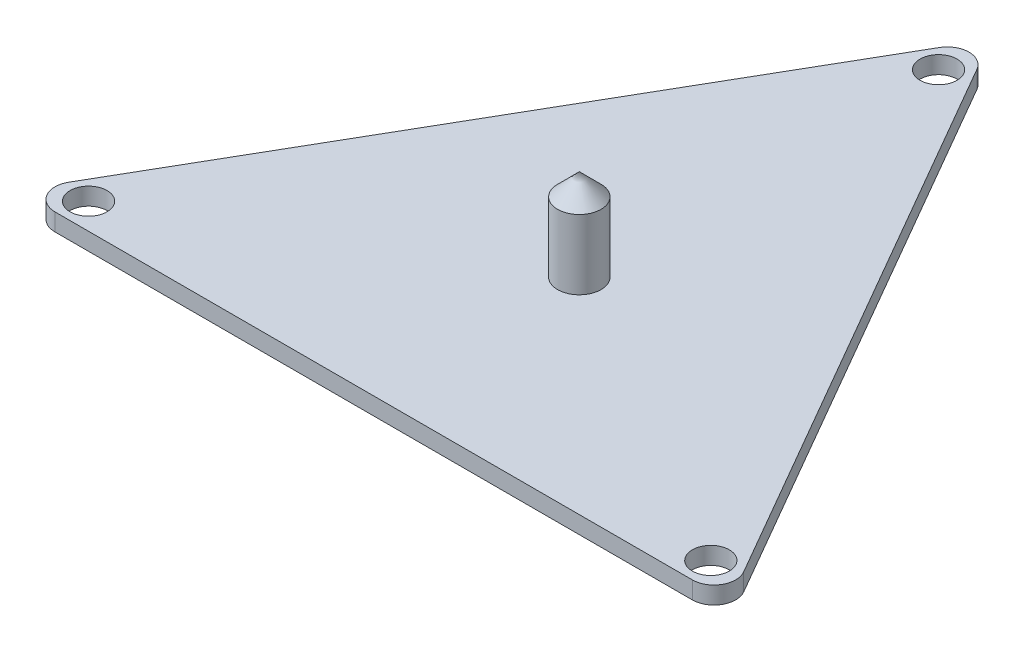
from build123d import *

# Parameters (mm, degrees)
BOSS_EXTRUDE1_DEPTH      = 40
F_1_0_1_DIAMETER_HOLE1_D = 85
SKETCH8_R                = 50
BOSS_EXTRUDE2_DEPTH      = 250
FILLET1_R                = 50
CHAMFER1_SIZE            = 50


with BuildPart() as part:
    # Sketch1 → Boss-Extrude1 (new body)
    with BuildSketch(Plane(origin=(0, 0, 0), x_dir=(1, 0, 0), z_dir=(0, 1, 0))):
        Polygon((-65.68627451, 1095.876515785), (754.006770172, -323.873484215), (-885.379319192, -323.873484215), align=None)
    extrude(amount=BOSS_EXTRUDE1_DEPTH)

    # Ø1.0 (1) Diameter Hole1 (through all)
    with Locations(Plane(origin=(0, 40, 0), x_dir=(1, 0, 0), z_dir=(0, 1, 0))):
        with Locations((-65.68627451, 975.876515785), (-781.456270738, -263.873484215), (650.083721718, -263.873484215)):
            Hole(F_1_0_1_DIAMETER_HOLE1_D / 2)

    # Sketch8 → Boss-Extrude2 (add)
    with BuildSketch(Plane(origin=(0, 0, 0), x_dir=(-1, 0, 0), z_dir=(0, -1, 0))):
        with Locations(Location((65.68627451, 149.376515785, 0), (0, 0, 90))):
            Circle(SKETCH8_R)
    extrude(amount=-BOSS_EXTRUDE2_DEPTH)

    # Fillet1
    fillet1_edges = [part.edges().sort_by_distance(p)[0] for p in [
        (-885.379319192, 20, 323.873484215),
        (754.006770172, 20, 323.873484215),
        (-65.68627451, 20, -1095.876515785),
    ]]
    fillet(fillet1_edges, radius=FILLET1_R)

    # Chamfer1
    chamfer1_edges = [part.edges().sort_by_distance(p)[0] for p in [
        (-65.68627451, 250, -99.376515785),
    ]]
    chamfer(chamfer1_edges, length=CHAMFER1_SIZE)


solid = part.part
